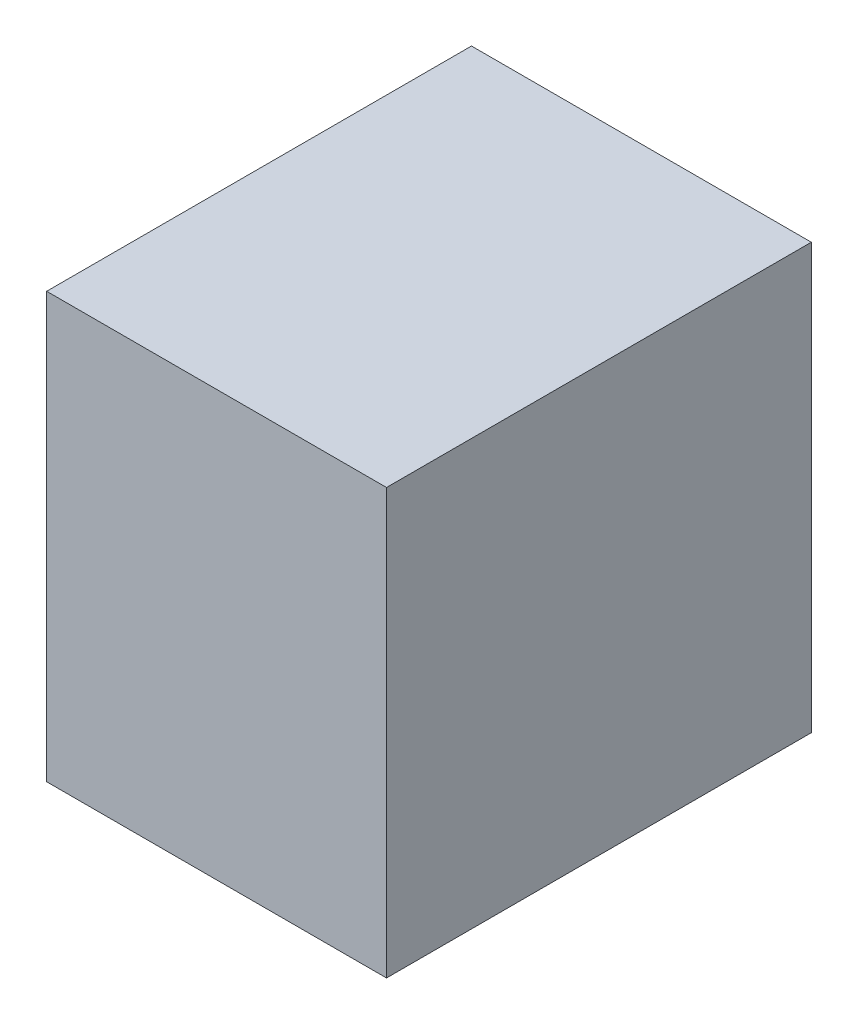
from build123d import *

# Parameters (mm, degrees)
SKETCH1_W           = 25.4
SKETCH1_H           = 31.75
BOSS_EXTRUDE1_DEPTH = 31.75


with BuildPart() as part:
    # Sketch1 → Boss-Extrude1 (new body)
    with BuildSketch(Plane.XY):
        with Locations((1.634325662, 34.373398575)):
            Rectangle(SKETCH1_W, SKETCH1_H)
    extrude(amount=BOSS_EXTRUDE1_DEPTH)


solid = part.part
